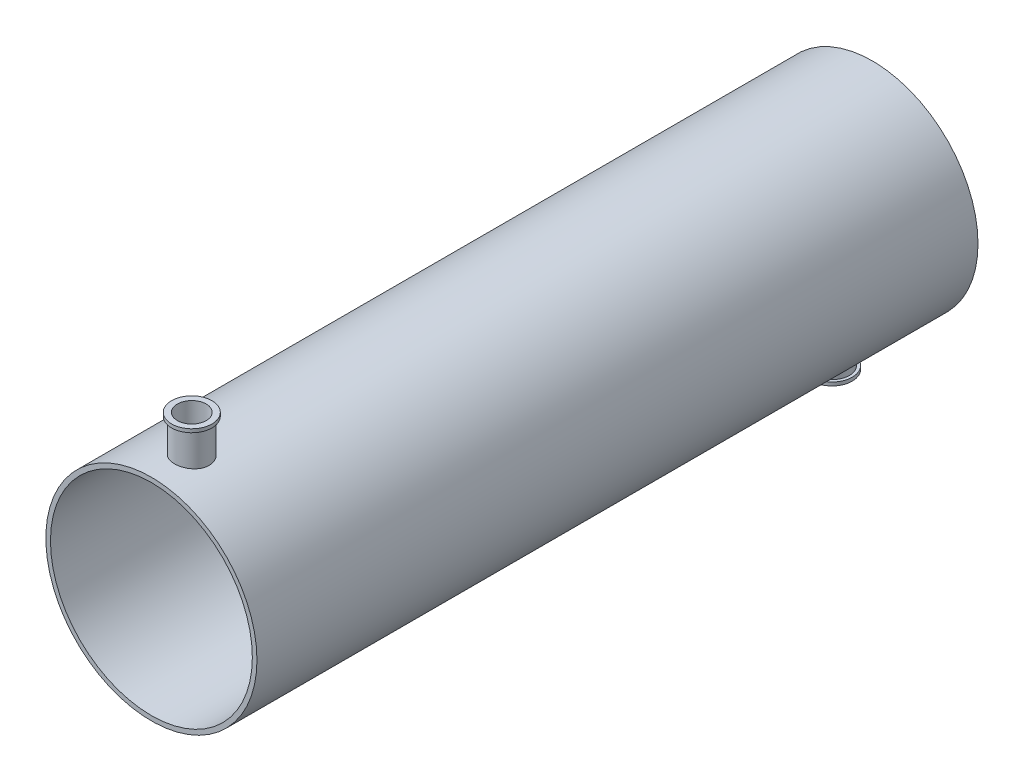
from build123d import *
from build123d.topology import SkipClean

# Parameters (mm, degrees)
SKETCH1_R           = 464.82
SKETCH1_R_2         = 444.5
BOSS_EXTRUDE1_DEPTH = 3175
BOSS_EXTRUDE2_START = 369.2906
SKETCH2_R           = 76.2
SKETCH2_R_2         = 63.5
BOSS_EXTRUDE2_DEPTH = 254
SKETCH3_R           = 63.5
CUT_EXTRUDE1_DEPTH  = 742.4928
BOSS_EXTRUDE3_START = -15.24
SKETCH4_R           = 88.9
SKETCH4_R_2         = 76.2
BOSS_EXTRUDE3_DEPTH = 15.24
BOSS_EXTRUDE4_START = -369.2906
SKETCH5_R           = 76.2
SKETCH5_R_2         = 63.5
BOSS_EXTRUDE4_DEPTH = 254
CUT_EXTRUDE2_START  = -736.6
SKETCH6_R           = 63.5
CUT_EXTRUDE2_DEPTH  = 736.6
SKETCH7_R           = 444.5
CUT_EXTRUDE3_DEPTH  = 3175
BOSS_EXTRUDE5_START = -15.24
SKETCH9_R           = 88.9
SKETCH9_R_2         = 76.2
BOSS_EXTRUDE5_DEPTH = 15.24


with BuildPart() as part:
    # Sketch1 → Boss-Extrude1 (new body)
    with BuildSketch(Plane.XY):
        Circle(SKETCH1_R)
        Circle(SKETCH1_R_2, mode=Mode.SUBTRACT)
    extrude(amount=-BOSS_EXTRUDE1_DEPTH)

    # Sketch2 → Boss-Extrude2 (add)
    with BuildSketch(Plane(origin=(0, 0, 0), x_dir=(1, 0, 0), z_dir=(0, 1, 0)).offset(BOSS_EXTRUDE2_START)):
        with Locations(Location((0, 177.8, 0), (0, 0, 90))):
            Circle(SKETCH2_R)
        with Locations(Location((0, 177.8, 0), (0, 0, 90))):
            Circle(SKETCH2_R_2, mode=Mode.SUBTRACT)
    extrude(amount=BOSS_EXTRUDE2_DEPTH)

    # Sketch3 → Cut-Extrude1 (cut)
    with SkipClean():  # the faces are left unmerged after this step: merging them gives an invalid solid
        with BuildSketch(Plane.XZ.offset(-369.2906)):
            with Locations(Location((0, -177.8, 0), (0, 0, 90))):
                Circle(SKETCH3_R)
        extrude(amount=-CUT_EXTRUDE1_DEPTH, mode=Mode.SUBTRACT)

    # Sketch4 → Boss-Extrude3 (add)
    with BuildSketch(Plane(origin=(0, 623.2906, 0), x_dir=(1, 0, 0), z_dir=(0, 1, 0)).offset(BOSS_EXTRUDE3_START)):
        with Locations(Location((0, 177.8, 0), (0, 0, 270))):
            Circle(SKETCH4_R)
        with Locations(Location((0, 177.8, 0), (0, 0, 90))):
            Circle(SKETCH4_R_2, mode=Mode.SUBTRACT)
    extrude(amount=BOSS_EXTRUDE3_DEPTH)

    # Sketch5 → Boss-Extrude4 (add)
    with BuildSketch(Plane(origin=(0, 0, 0), x_dir=(1, 0, 0), z_dir=(0, 1, 0)).offset(BOSS_EXTRUDE4_START)):
        with Locations(Location((0, 2997.2, 0), (0, 0, 270))):
            Circle(SKETCH5_R)
        with Locations(Location((0, 2997.2, 0), (0, 0, 270))):
            Circle(SKETCH5_R_2, mode=Mode.SUBTRACT)
    extrude(amount=-BOSS_EXTRUDE4_DEPTH)

    # Sketch6 → Cut-Extrude2 (cut)
    with BuildSketch(Plane.XZ.offset(623.2906).offset(CUT_EXTRUDE2_START)):
        with Locations(Location((0, -2997.2, 0), (0, 0, 90))):
            Circle(SKETCH6_R)
    extrude(amount=CUT_EXTRUDE2_DEPTH, mode=Mode.SUBTRACT)

    # Sketch7 → Cut-Extrude3 (cut)
    with BuildSketch(Plane.XY):
        Circle(SKETCH7_R)
    extrude(amount=-CUT_EXTRUDE3_DEPTH, mode=Mode.SUBTRACT)

    # Sketch9 → Boss-Extrude5 (add)
    with SkipClean():  # the faces are left unmerged after this step: merging them gives an invalid solid
        with BuildSketch(Plane.XZ.offset(623.2906).offset(BOSS_EXTRUDE5_START)):
            with Locations(Location((0, -2997.2, 0), (0, 0, 270))):
                Circle(SKETCH9_R)
            with Locations(Location((0, -2997.2, 0), (0, 0, 90))):
                Circle(SKETCH9_R_2, mode=Mode.SUBTRACT)
        extrude(amount=BOSS_EXTRUDE5_DEPTH)


solid = part.part
